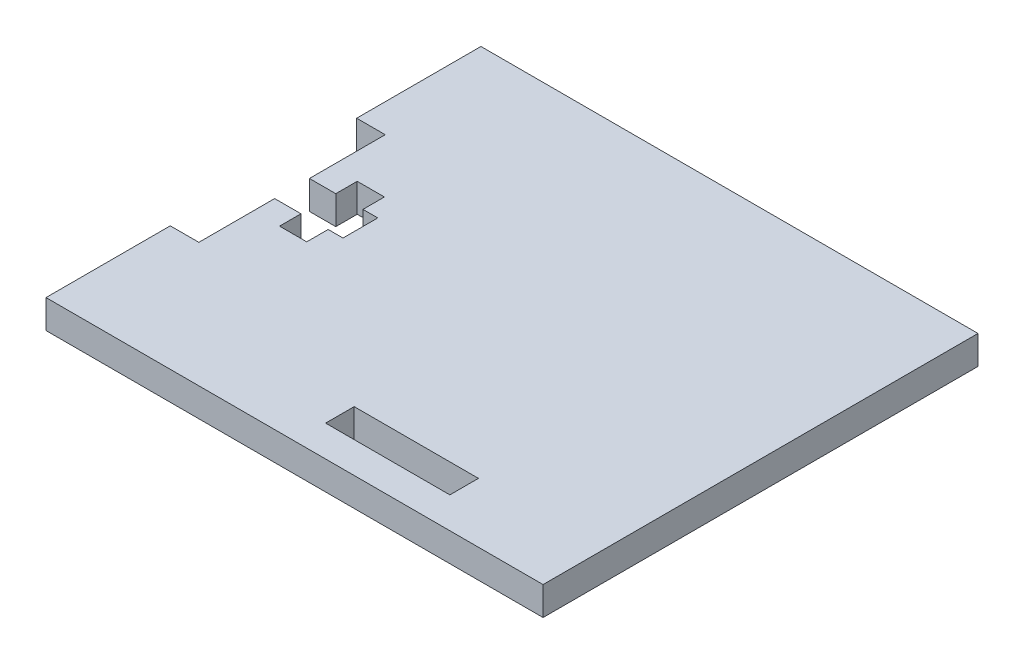
from build123d import *

# Parameters (mm, degrees)
SKETCH1_W           = 12.7
SKETCH1_H           = 2.921
BOSS_EXTRUDE1_DEPTH = 2.921


with BuildPart() as part:
    # Sketch1 → Boss-Extrude1 (new body)
    with BuildSketch(Plane(origin=(0, 0, 0), x_dir=(1, 0, 0), z_dir=(0, 1, 0))):
        Polygon((0, 31.75), (0, 44.45), (50.8, 44.45), (50.8, 0), (0, 0), (0, 12.7), (2.921, 12.7), (2.921, 20.447), (5.612336386, 20.447), (5.612336386, 18.25625), (8.390461386, 18.25625), (8.390461386, 20.447), (9.906, 20.447), (9.906, 24.003), (8.390461386, 24.003), (8.390461386, 26.19375), (5.612336386, 26.19375), (5.612336386, 24.003), (2.921, 24.003), (2.921, 31.75), align=None)
        with Locations((31.75, 4.6355)):
            Rectangle(SKETCH1_W, SKETCH1_H, mode=Mode.SUBTRACT)
    extrude(amount=BOSS_EXTRUDE1_DEPTH)


solid = part.part
